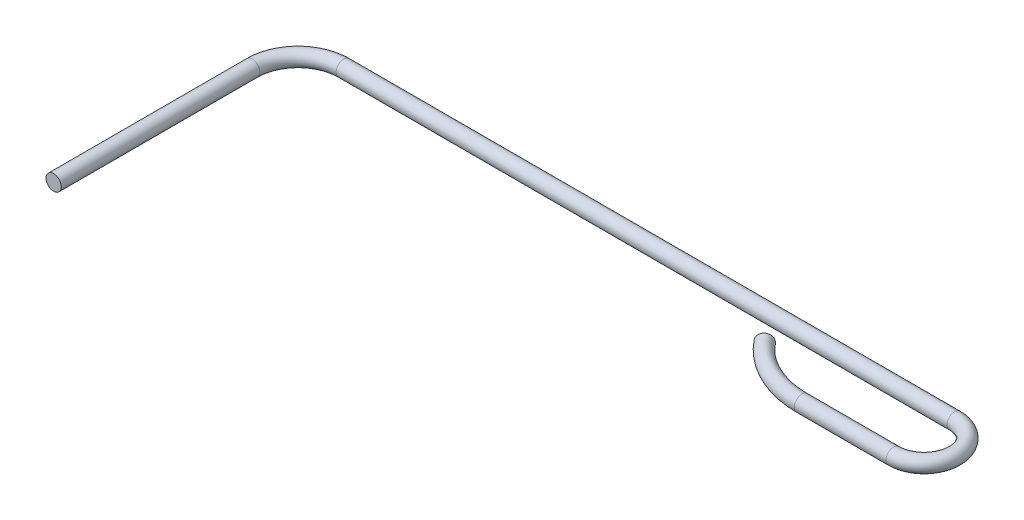
from build123d import *

# Parameters (mm, degrees)
SKETCH2_R = 2.5


with BuildPart() as part:
    # Sweep1: sweep along a path in Sketch1
    with BuildLine(Plane(origin=(0, 0, 0), x_dir=(1, 0, 0), z_dir=(0, 1, 0))) as sweep1_path:
        Line((0, 0), (0, 65))
        ThreePointArc((0, 65), (4.393398282, 75.606601718), (15, 80))
        Line((15, 80), (215, 80))
        ThreePointArc((215, 80), (225, 70), (215, 60))
        Line((215, 60), (185, 60))
        ThreePointArc((185, 60), (172.034701688, 62.946330384), (161.616073533, 71.206597355))
    # Sketch2 → Sweep1 (sweep)
    with BuildSketch(Plane.XY):
        Circle(SKETCH2_R)
    sweep(path=sweep1_path.line)


solid = part.part
